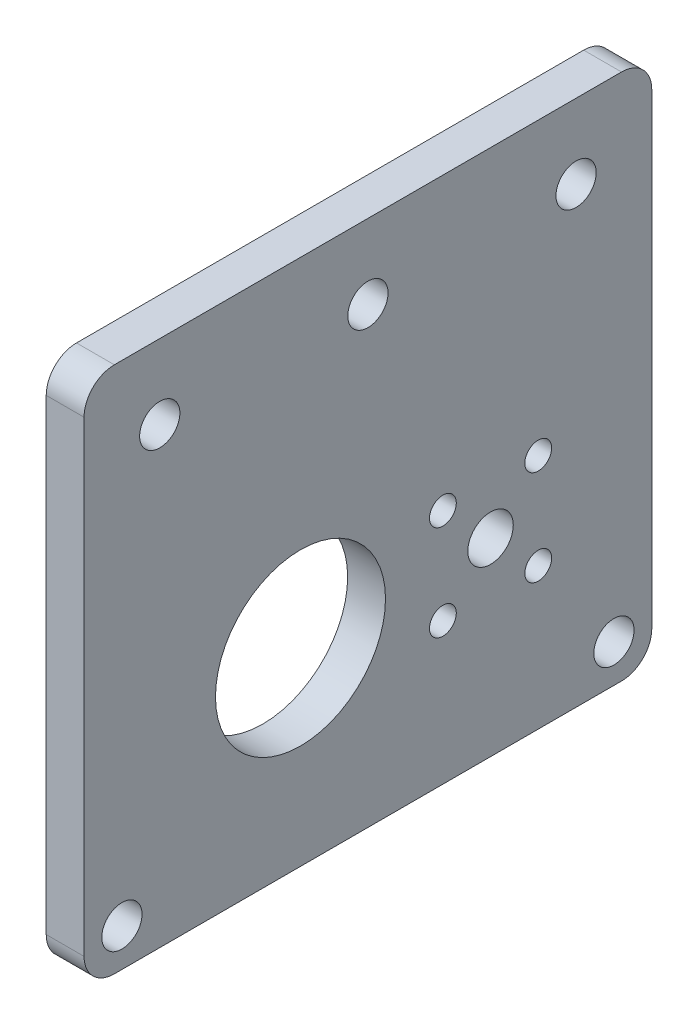
from build123d import *

# Parameters (mm, degrees)
SKETCH1_W                                       = 95.25
SKETCH1_H                                       = 25
SKETCH1_H_2                                     = 63.5
SKETCH1_R                                       = 14.2621
SKETCH1_R_2                                     = 3.81
BOSS_EXTRUDE1_DEPTH                             = 6.35
F_1_4_CLEARANCE_HOLE2_D                         = 6.7564
FILLET1_R                                       = 5.08
CSK_FOR_M4_FLAT_HEAD_MACHINE_SCREW2_D           = 4.5
CSK_FOR_M4_FLAT_HEAD_MACHINE_SCREW2_CSINK_D     = 9.4
CSK_FOR_M4_FLAT_HEAD_MACHINE_SCREW2_CSINK_ANGLE = 90


with BuildPart() as part:
    # Sketch1 → Boss-Extrude1 (new body)
    # profile 1 of 2: a face of its own
    with BuildSketch(Plane(origin=(0, 0, 0), x_dir=(0, 0, -1), z_dir=(1, 0, 0))):
        with Locations((-20.575, 44.25)):
            Rectangle(SKETCH1_W, SKETCH1_H)
    # profile 2 of 2: a face of its own
    with BuildSketch(Plane(origin=(0, 0, 0), x_dir=(0, 0, -1), z_dir=(1, 0, 0))):
        with Locations((-20.575, 0)):
            Rectangle(SKETCH1_W, SKETCH1_H_2)
        with Locations((-31.8887, 0)):
            Circle(SKETCH1_R, mode=Mode.SUBTRACT)
        Circle(SKETCH1_R_2, mode=Mode.SUBTRACT)
    extrude(amount=BOSS_EXTRUDE1_DEPTH)

    # 1/4 Clearance Hole2 (through all)
    with Locations(Plane(origin=(6.35, 0, 0), x_dir=(0, 0, -1), z_dir=(1, 0, 0))):
        with Locations((-55.5, 44.25), (-20.575, 44.25), (14.35, 44.25), (-61.85, -25.4), (20.7, -25.4)):
            Hole(F_1_4_CLEARANCE_HOLE2_D / 2)

    # Fillet1
    fillet1_edges = [part.edges().sort_by_distance(p)[0] for p in [
        (3.175, -31.75, -27.05),
        (3.175, -31.75, 68.2),
        (3.175, 56.75, 68.2),
        (3.175, 56.75, -27.05),
    ]]
    fillet(fillet1_edges, radius=FILLET1_R)

    # CSK for M4 Flat Head Machine Screw2 (through all)
    with Locations(Plane.ZY):
        with Locations((-8, 8), (8, 8), (8, -8), (-8, -8)):
            CounterSinkHole(CSK_FOR_M4_FLAT_HEAD_MACHINE_SCREW2_D / 2, CSK_FOR_M4_FLAT_HEAD_MACHINE_SCREW2_CSINK_D / 2, counter_sink_angle=CSK_FOR_M4_FLAT_HEAD_MACHINE_SCREW2_CSINK_ANGLE)


solid = part.part
